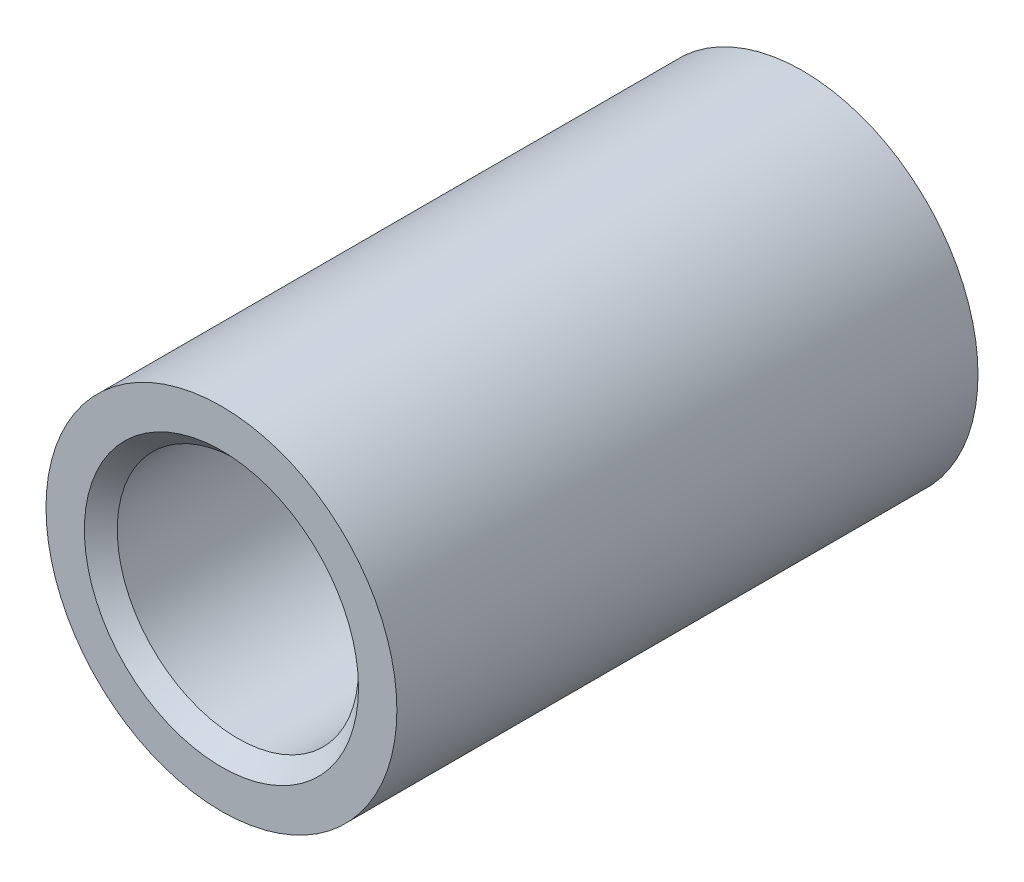
from build123d import *

# Parameters (mm, degrees)
IZIM2_R                     = 16
IZIM2_R_2                   = 11
Y_KSEKLIK_EKSTR_ZYON1_DEPTH = 53
PAH2_SIZE                   = 1.5


with BuildPart() as part:
    # Çizim2 → Yükseklik-Ekstrüzyon1 (new body)
    with BuildSketch(Plane.XY):
        Circle(IZIM2_R)
        Circle(IZIM2_R_2, mode=Mode.SUBTRACT)
    extrude(amount=Y_KSEKLIK_EKSTR_ZYON1_DEPTH)

    # Pah2
    pah2_edges = [part.edges().sort_by_distance(p)[0] for p in [
        (-11, 0, 0),
        (-11, 0, 53),
    ]]
    chamfer(pah2_edges, length=PAH2_SIZE)


solid = part.part
